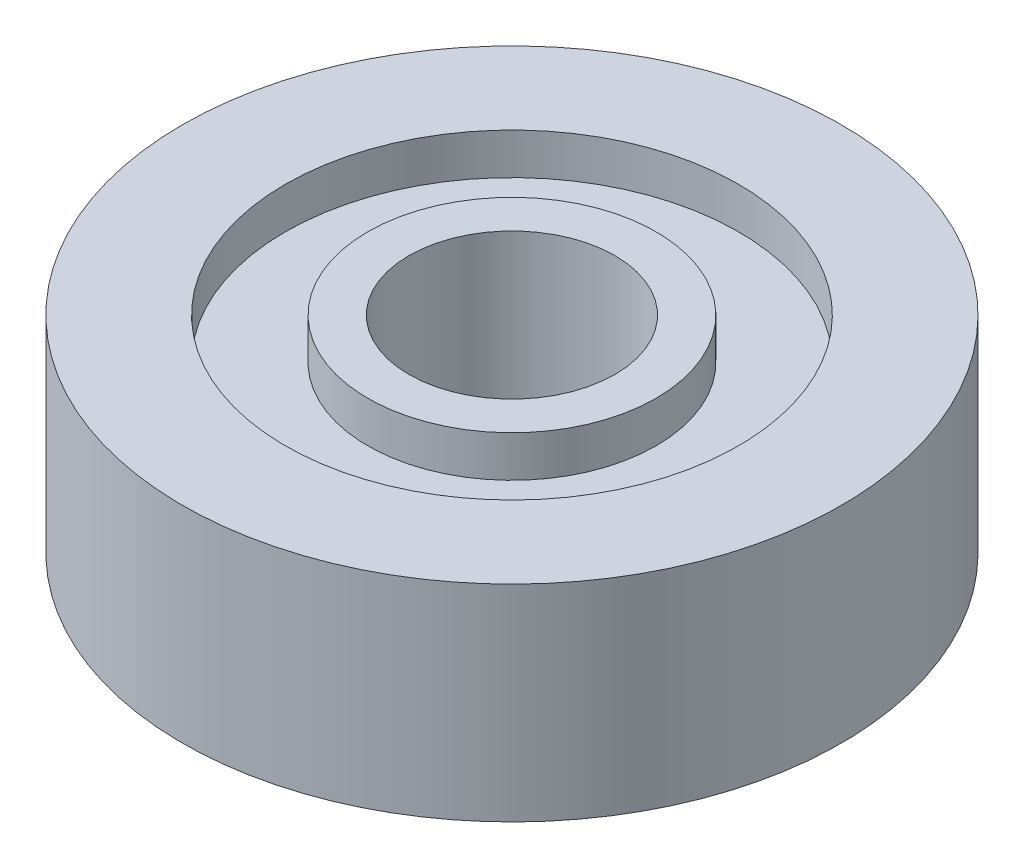
from build123d import *


with BuildPart() as part:
    # Sketch1 → Revolve1 (revolve)
    with BuildSketch(Plane.XY, mode=Mode.PRIVATE) as revolve1_sk:
        Polygon((3.602742578, -2.5), (4.602742578, -2.5), (4.602742578, -1.5), (6.602742578, -1.5), (6.602742578, -2.5), (9.102742578, -2.5), (9.102742578, 2.5), (6.602742578, 2.5), (6.602742578, 1.5), (4.602742578, 1.5), (4.602742578, 2.5), (3.602742578, 2.5), align=None)
    revolve(revolve1_sk.sketch.rotate(Axis((1.102742578, 7.86964268, 0), (0, -1, 0)), 180), axis=Axis((1.102742578, 7.86964268, 0), (0, -1, 0)))


solid = part.part
